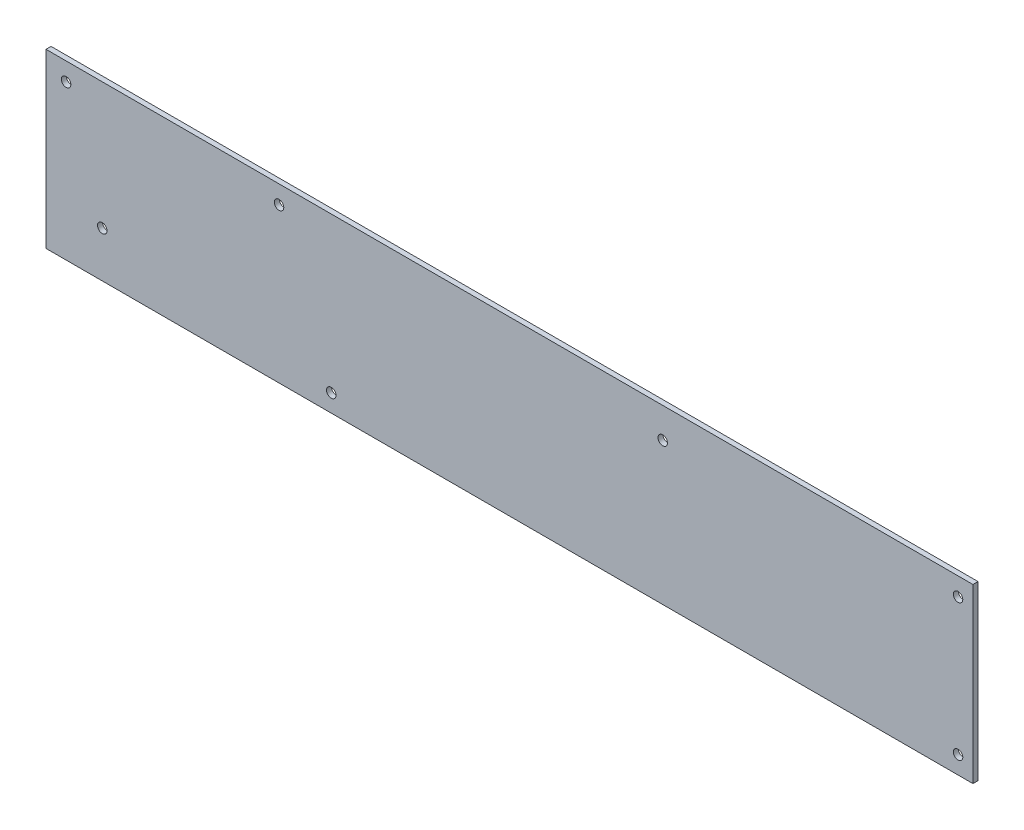
from build123d import *

# Parameters (mm, degrees)
SKETCH2_W                       = 293
SKETCH2_H                       = 54.52
EXTRUDEDBASE_PCB_DEPTH          = 1.6
SKETCH3_R                       = 1.5
EXTRUDEDCUT_MOUNTINGHOLES_DEPTH = 150.023211615


with BuildPart() as part:
    # Sketch2 → ExtrudedBase_PCB (new body)
    with BuildSketch(Plane.XY):
        Rectangle(SKETCH2_W, SKETCH2_H)
    extrude(amount=EXTRUDEDBASE_PCB_DEPTH)

    # Sketch3 → ExtrudedCut_MountingHoles (cut, through all)
    with BuildSketch(Plane.XY.offset(1.6)):
        with Locations((-140.15, 21.508)):
            Circle(SKETCH3_R)
        with Locations((-72.84, 21.508)):
            Circle(SKETCH3_R)
        with Locations((48.445, 17.698)):
            Circle(SKETCH3_R)
        with Locations((141.79, 21.508)):
            Circle(SKETCH3_R)
        with Locations((-128.72, -12.782)):
            Circle(SKETCH3_R)
        with Locations((-56.33, -21.672)):
            Circle(SKETCH3_R)
        with Locations((141.79, -21.672)):
            Circle(SKETCH3_R)
    extrude(amount=-EXTRUDEDCUT_MOUNTINGHOLES_DEPTH, mode=Mode.SUBTRACT)


solid = part.part
